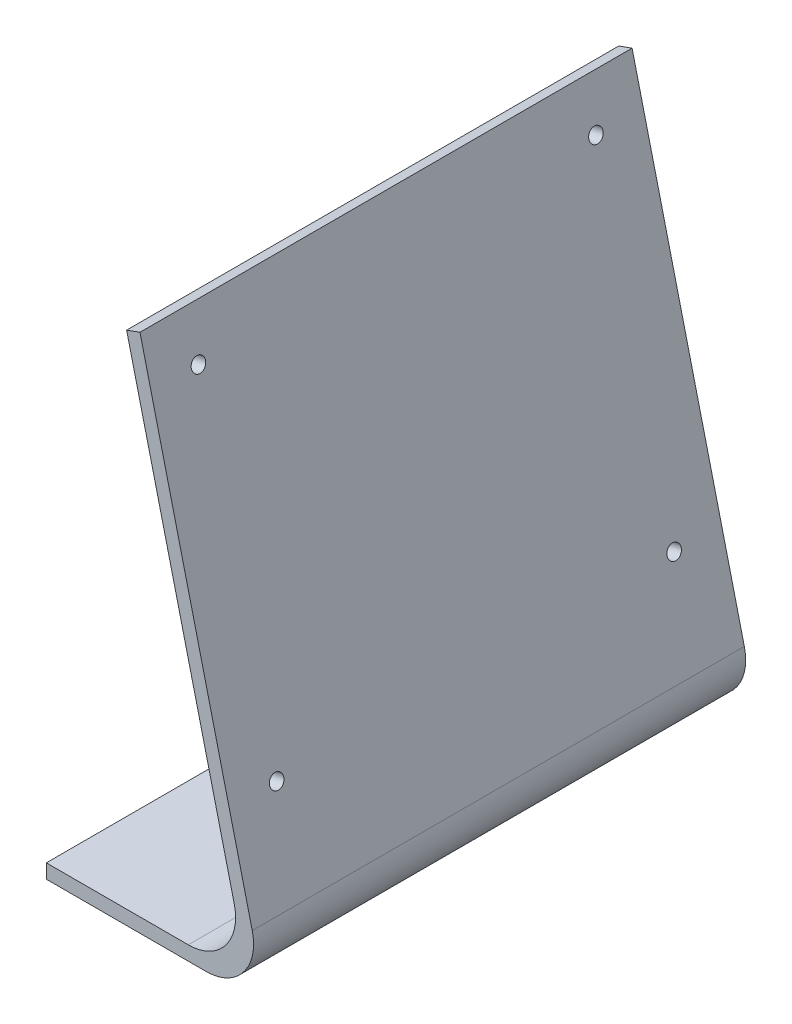
from build123d import *

# Parameters (mm, degrees)
BOSS_EXTRUDE1_DEPTH = 52
CUT_EXTRUDE_1_REACH = 133.119
SKETCH_2_R          = 1.5


with BuildPart() as part:
    # Sketch1 → Boss-Extrude1 (new, symmetric)
    with BuildSketch(Plane.XY):
        with BuildLine():
            Line((-50.530004832, 0), (-50.530004832, 3))
            Line((-50.530004832, 3), (-20.530004832, 3))
            ThreePointArc((-20.530004832, 3), (-12.668388321, 6.819790793), (-10.812717884, 15.361002831))
            Line((-10.812717884, 15.361002831), (-33.559523327, 108.981066609))
            Line((-33.559523327, 108.981066609), (-30.737861628, 110))
            Line((-30.737861628, 110), (-7.014578577, 12.361002831))
            ThreePointArc((-7.014578577, 12.361002831), (-8.870249014, 3.819790793), (-16.731865525, 0))
            Line((-16.731865525, 0), (-50.530004832, 0))
        make_face()
    extrude(amount=BOSS_EXTRUDE1_DEPTH, both=True)

    # Эскиз2 → Вырез-Вытянуть1 (cut, up to next)
    with BuildSketch(Plane(origin=(-3.787634246, -0.920279007, 0), x_dir=(0, 0, -1), z_dir=(0.9717286948053453, 0.2361002831254127, 0)), mode=Mode.PRIVATE) as cut_extrude_1_sk1:
        with Locations(Location((-42, 104.147374262, 0), (0, 0, 90))):
            Circle(SKETCH_2_R)
    cut_extrude_1_tool1 = extrude(cut_extrude_1_sk1.sketch, amount=-CUT_EXTRUDE_1_REACH, mode=Mode.PRIVATE) & part.part
    # Эскиз2 → Вырез-Вытянуть1 (cut, up to next)
    with BuildSketch(Plane(origin=(-3.787634246, -0.920279007, 0), x_dir=(0, 0, -1), z_dir=(0.9717286948053453, 0.2361002831254127, 0)), mode=Mode.PRIVATE) as cut_extrude_1_sk2:
        with Locations(Location((42, 104.147374262, 0), (0, 0, 90))):
            Circle(SKETCH_2_R)
    cut_extrude_1_tool2 = extrude(cut_extrude_1_sk2.sketch, amount=-CUT_EXTRUDE_1_REACH, mode=Mode.PRIVATE) & part.part
    # Эскиз2 → Вырез-Вытянуть1 (cut, up to next)
    with BuildSketch(Plane(origin=(-3.787634246, -0.920279007, 0), x_dir=(0, 0, -1), z_dir=(0.9717286948053453, 0.2361002831254127, 0)), mode=Mode.PRIVATE) as cut_extrude_1_sk3:
        with Locations(Location((42, 34.147374262, 0), (0, 0, 90))):
            Circle(SKETCH_2_R)
    cut_extrude_1_tool3 = extrude(cut_extrude_1_sk3.sketch, amount=-CUT_EXTRUDE_1_REACH, mode=Mode.PRIVATE) & part.part
    # Эскиз2 → Вырез-Вытянуть1 (cut, up to next)
    with BuildSketch(Plane(origin=(-3.787634246, -0.920279007, 0), x_dir=(0, 0, -1), z_dir=(0.9717286948053453, 0.2361002831254127, 0)), mode=Mode.PRIVATE) as cut_extrude_1_sk4:
        with Locations(Location((-42, 34.147374262, 0), (0, 0, 90))):
            Circle(SKETCH_2_R)
    cut_extrude_1_tool4 = extrude(cut_extrude_1_sk4.sketch, amount=-CUT_EXTRUDE_1_REACH, mode=Mode.PRIVATE) & part.part
    add(cut_extrude_1_tool1.solids().sort_by_distance((-28.376859, 100.282713, 42))[0], mode=Mode.SUBTRACT)
    add(cut_extrude_1_tool2.solids().sort_by_distance((-28.376859, 100.282713, -42))[0], mode=Mode.SUBTRACT)
    add(cut_extrude_1_tool3.solids().sort_by_distance((-11.849839, 32.261704, -42))[0], mode=Mode.SUBTRACT)
    add(cut_extrude_1_tool4.solids().sort_by_distance((-11.849839, 32.261704, 42))[0], mode=Mode.SUBTRACT)


solid = part.part
